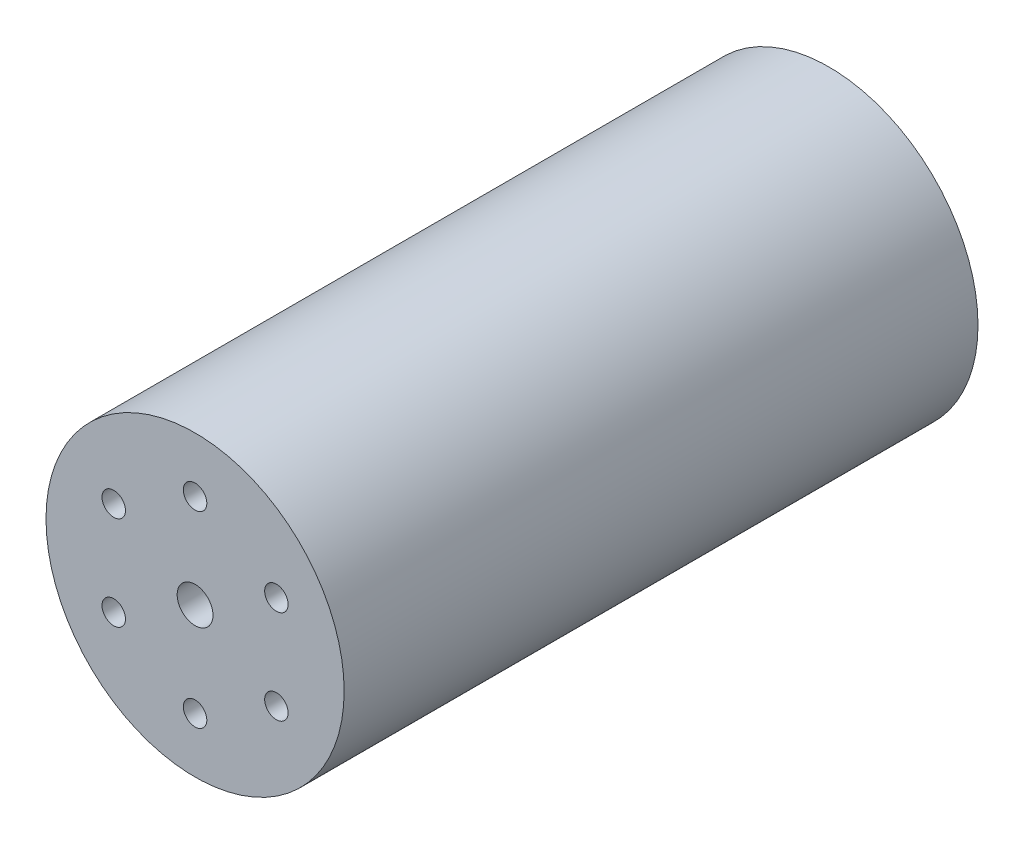
from build123d import *

# Parameters (mm, degrees)
SKETCH2_R           = 31.75
BOSS_EXTRUDE1_DEPTH = 135
SKETCH3_R           = 3.815
CUT_EXTRUDE1_DEPTH  = 135
SKETCH5_R           = 22.225
CUT_EXTRUDE2_DEPTH  = 30
SKETCH6_R           = 2.5
CUT_EXTRUDE3_DEPTH  = 5
SKETCH6_3_R         = 2.5
CUT_EXTRUDE4_DEPTH  = 5


with BuildPart() as part:
    # Sketch2 → Boss-Extrude1 (new body)
    with BuildSketch(Plane.XY):
        Circle(SKETCH2_R)
    extrude(amount=BOSS_EXTRUDE1_DEPTH)

    # Sketch3 → Cut-Extrude1 (cut)
    with BuildSketch(Plane(origin=(0, 0, 0), x_dir=(-1, 0, 0), z_dir=(0, 0, -1))):
        Circle(SKETCH3_R)
    extrude(amount=-CUT_EXTRUDE1_DEPTH, mode=Mode.SUBTRACT)

    # Sketch5 → Cut-Extrude2 (cut)
    with BuildSketch(Plane(origin=(0, 0, 0), x_dir=(-1, 0, 0), z_dir=(0, 0, -1))):
        Circle(SKETCH5_R)
    extrude(amount=-CUT_EXTRUDE2_DEPTH, mode=Mode.SUBTRACT)

    # Sketch6 → Cut-Extrude3 (cut)
    with BuildSketch(Plane.XY.offset(135)):
        with Locations((0, 20)):
            Circle(SKETCH6_R)
    extrude(amount=-CUT_EXTRUDE3_DEPTH, mode=Mode.SUBTRACT)

    # Sketch6<3> → Cut-Extrude4 (cut)
    with BuildSketch(Plane.XY.offset(135)):
        with Locations((0, 20)):
            Circle(SKETCH6_3_R)
        with Locations((17.320508076, 10)):
            Circle(SKETCH6_3_R)
        with Locations((17.320508076, -10)):
            Circle(SKETCH6_3_R)
        with Locations((0, -20)):
            Circle(SKETCH6_3_R)
        with Locations((-17.320508076, -10)):
            Circle(SKETCH6_3_R)
        with Locations((-17.320508076, 10)):
            Circle(SKETCH6_3_R)
    extrude(amount=-CUT_EXTRUDE4_DEPTH, mode=Mode.SUBTRACT)


solid = part.part
